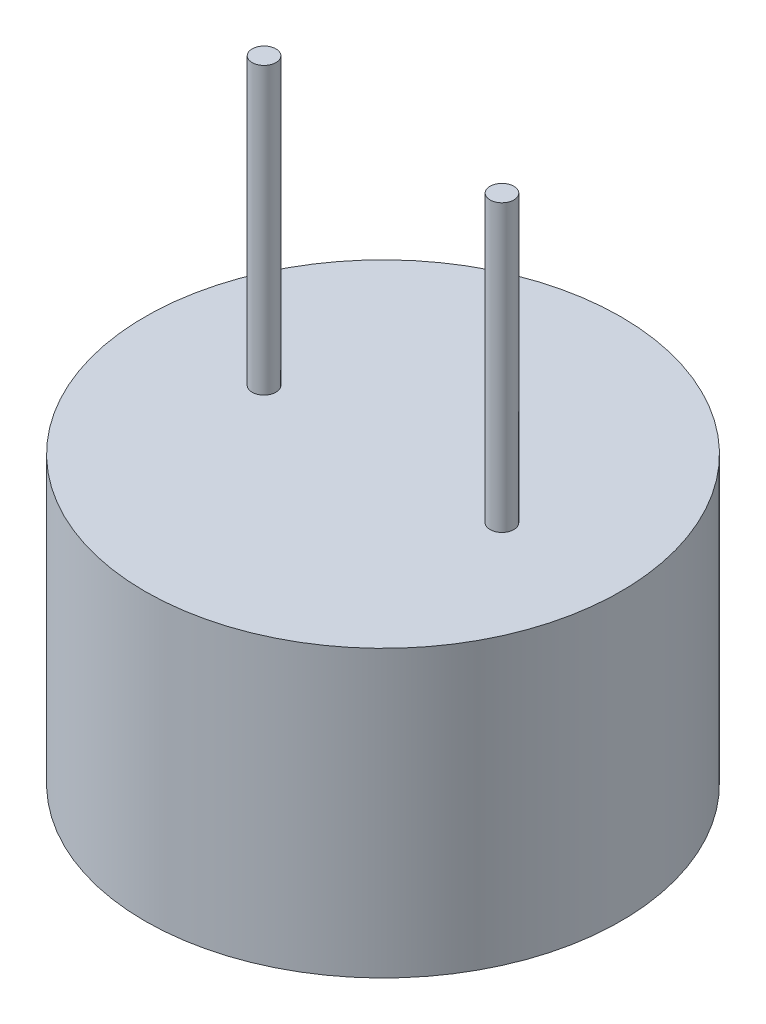
from build123d import *

# Parameters (mm, degrees)
SKETCH_1_R      = 5
EXTRUDE_1_DEPTH = 6
SKETCH_2_R      = 0.25
EXTRUDE_2_DEPTH = 6


with BuildPart() as part:
    # Эскиз1 → Бобышка-Вытянуть1 (new body)
    with BuildSketch(Plane(origin=(0, 0, 0), x_dir=(1, 0, 0), z_dir=(0, 1, 0))):
        with Locations(Location((0, 0, 0), (0, 0, 270))):
            Circle(SKETCH_1_R)
    extrude(amount=EXTRUDE_1_DEPTH)

    # Эскиз2 → Бобышка-Вытянуть2 (add)
    with BuildSketch(Plane(origin=(0, 6, 0), x_dir=(1, 0, 0), z_dir=(0, 1, 0))):
        with Locations(Location((-2.5, 0, 0), (0, 0, 270))):
            Circle(SKETCH_2_R)
        with Locations(Location((2.5, 0, 0), (0, 0, 90))):
            Circle(SKETCH_2_R)
    extrude(amount=EXTRUDE_2_DEPTH)


solid = part.part
